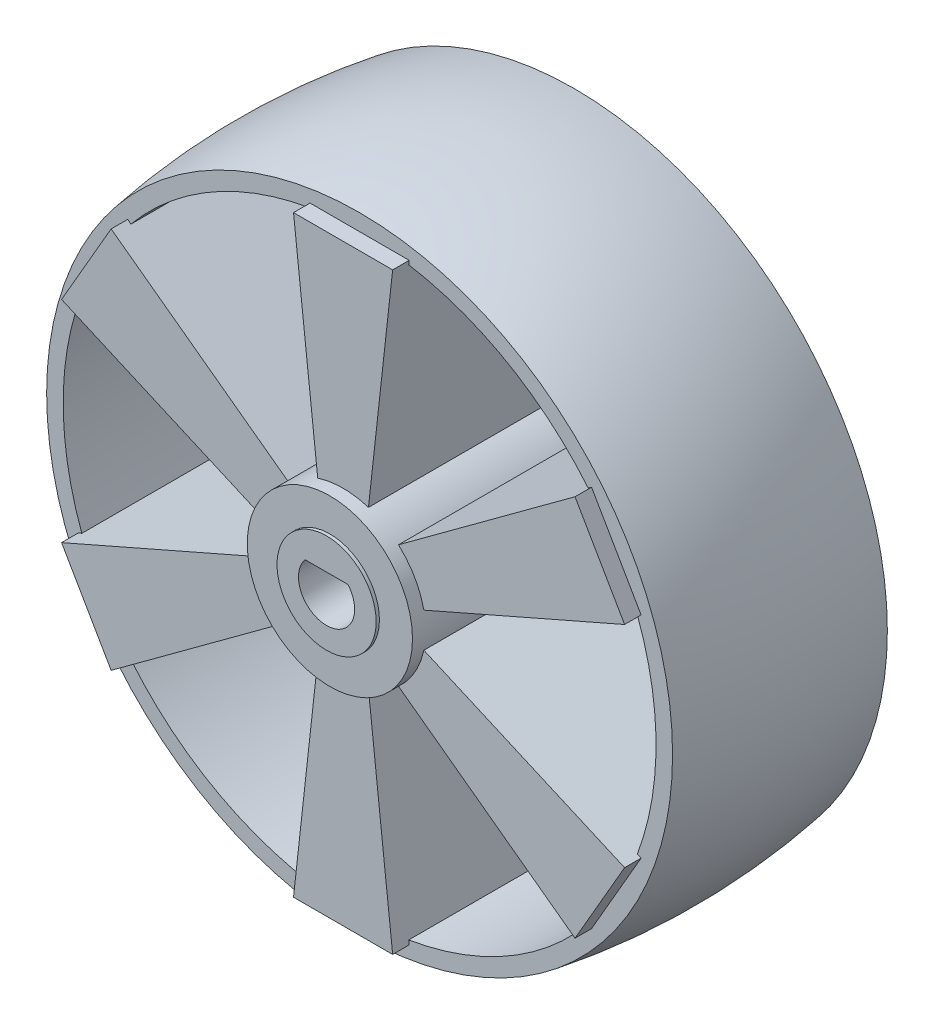
from build123d import *

# Parameters (mm, degrees)
CROQUIS1_R              = 3
SALIENTE_EXTRUIR1_DEPTH = 5
CROQUIS2_R              = 5.000500025
SALIENTE_EXTRUIR2_DEPTH = 10
CROQUIS3_R              = 5.000500025
CROQUIS3_R_2            = 3
SALIENTE_EXTRUIR3_DEPTH = 4.8
SALIENTE_EXTRUIR4_DEPTH = 14


with BuildPart() as part:
    # Croquis1 → Saliente-Extruir1 (new body)
    with BuildSketch(Plane.XY):
        Circle(CROQUIS1_R)
        with BuildLine():
            Line((-1.29614814, 1.1), (1.29614814, 1.1))
            ThreePointArc((1.29614814, 1.1), (0, -1.7), (-1.29614814, 1.1))
        make_face(mode=Mode.SUBTRACT)
    extrude(amount=SALIENTE_EXTRUIR1_DEPTH)

    # Croquis2 → Saliente-Extruir2 (add)
    with BuildSketch(Plane(origin=(0, 0, 0), x_dir=(-1, 0, 0), z_dir=(0, 0, -1))):
        Circle(CROQUIS2_R)
    extrude(amount=SALIENTE_EXTRUIR2_DEPTH)

    # Croquis3 → Saliente-Extruir3 (add)
    with BuildSketch(Plane.XY):
        Circle(CROQUIS3_R)
        Circle(CROQUIS3_R_2, mode=Mode.SUBTRACT)
    extrude(amount=SALIENTE_EXTRUIR3_DEPTH)

    # Croquis4 → Saliente-Extruir4 (add)
    with BuildSketch(Plane(origin=(0, 0, -10), x_dir=(-1, 0, 0), z_dir=(0, 0, -1))):
        Polygon((-1.5, 4.442041839), (1.5, 4.442041839), (3, 17.942041839), (-3, 17.942041839), align=None)
        Polygon((17.038264028, 6.372944708), (14.038264028, 11.569097131), (3.096921077, 3.520059025), (4.596921077, 0.921982814), align=None)
        Polygon((14.038264028, -11.569097131), (17.038264028, -6.372944708), (4.596921077, -0.921982814), (3.096921077, -3.520059025), align=None)
        Polygon((-3, -17.942041839), (3, -17.942041839), (1.5, -4.442041839), (-1.5, -4.442041839), align=None)
        Polygon((-17.038264028, -6.372944708), (-14.038264028, -11.569097131), (-3.096921077, -3.520059025), (-4.596921077, -0.921982814), align=None)
        Polygon((-14.038264028, 11.569097131), (-17.038264028, 6.372944708), (-4.596921077, 0.921982814), (-3.096921077, 3.520059025), align=None)
    extrude(amount=-SALIENTE_EXTRUIR4_DEPTH)

    # Croquis6 → Revolución2 (revolve)
    with BuildSketch(Plane(origin=(0, 0, 0), x_dir=(0, 0, -1), z_dir=(1, 0, 0)), mode=Mode.PRIVATE) as revoluci_n2_sk:
        with BuildLine():
            Line((10, 17.942041839), (10, 18.942041839))
            ThreePointArc((10, 18.942041839), (3.5, 19.473700095), (-3, 18.942041839))
            Line((-3, 18.942041839), (-3, 17.942041839))
            Line((-3, 17.942041839), (10, 17.942041839))
        make_face()
    revolve(revoluci_n2_sk.sketch.rotate(Axis((0, 0, 4), (0, 0, -1)), 90), axis=Axis((0, 0, 4), (0, 0, -1)))


solid = part.part
